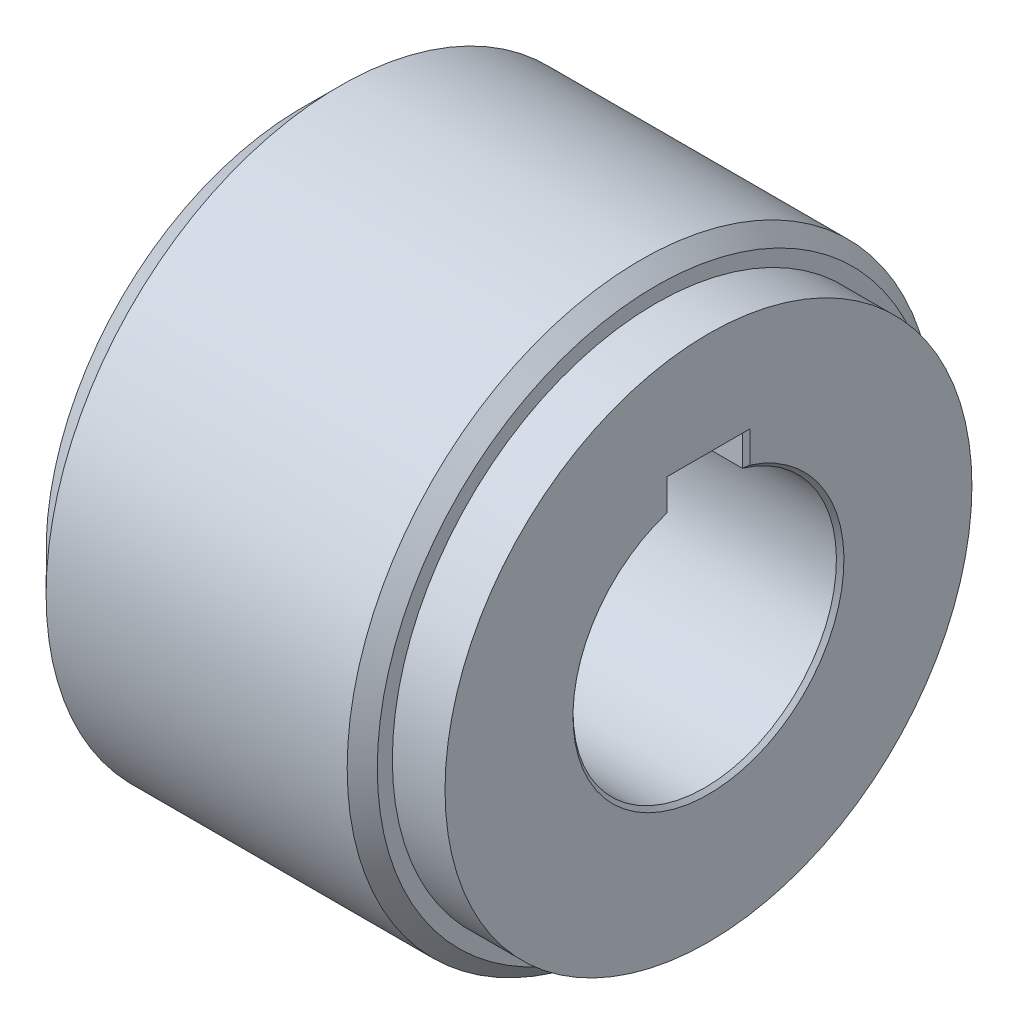
from build123d import *

# Parameters (mm, degrees)
SKETCH_1_R      = 39
EXTRUDE_1_DEPTH = 27
CHAMFER_1_SIZE  = 5
CHAMFER_2_SIZE  = 0.5


with BuildPart() as part:
    # Эскиз1 → Бобышка-Вытянуть1 (new, symmetric)
    with BuildSketch(Plane(origin=(0, 0, 0), x_dir=(0, 0, -1), z_dir=(1, 0, 0))):
        Circle(SKETCH_1_R)
        with BuildLine():
            Line((-5, 20.8), (5, 20.8))
            Line((5, 20.8), (5, 16.770509831))
            ThreePointArc((5, 16.770509831), (0, -17.5), (-5, 16.770509831))
            Line((-5, 16.770509831), (-5, 20.8))
        make_face(mode=Mode.SUBTRACT)
    extrude(amount=EXTRUDE_1_DEPTH, both=True)

    # Фаска1
    chamfer_1_edges = [part.edges().sort_by_distance(p)[0] for p in [
        (-27, 0, 39),
    ]]
    chamfer(chamfer_1_edges, length=CHAMFER_1_SIZE)

    # Фаска2
    chamfer_2_edges = [part.edges().sort_by_distance(p)[0] for p in [
        (27, 20.8, 0),
        (27, 18.785254916, 5),
        (-27, -17.5, 0),
        (-27, 18.785254916, -5),
        (-27, 20.8, 0),
        (-27, 18.785254916, 5),
        (27, -17.5, 0),
        (27, 18.785254916, -5),
    ]]
    chamfer(chamfer_2_edges, length=CHAMFER_2_SIZE)

    # Эскиз3 → Вырез-Повернуть1 (revolve, cut)
    with BuildSketch(Plane.XY, mode=Mode.PRIVATE) as cut_revolve_1_sk:
        Polygon((27, 35), (20, 35), (20, 37), (18, 39), (27, 39), align=None)
    revolve(cut_revolve_1_sk.sketch.rotate(Axis((0, 0, 0), (1, 0, 0)), 90), axis=Axis((0, 0, 0), (1, 0, 0)), mode=Mode.SUBTRACT)


solid = part.part
